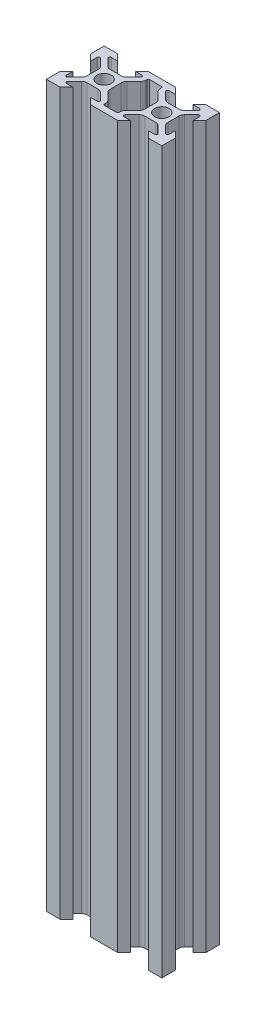
from build123d import *

# Parameters (mm, degrees)
SKETCH1_R           = 2.5
BOSS_EXTRUDE1_DEPTH = 250


with BuildPart() as part:
    # Sketch1 → Boss-Extrude1 (new body)
    with BuildSketch(Plane(origin=(0, 0, 0), x_dir=(0, 0, -1), z_dir=(0, -1, 0))):
        with BuildLine():
            Line((-10, 10), (-10, 5.3))
            Line((-10, 5.3), (-7.8, 3.1))
            Line((-7.8, 3.1), (-7.8, 5.320101013))
            ThreePointArc((-7.8, 5.320101013), (-7.491341716, 5.782040779), (-6.946446609, 5.673654403))
            Line((-6.946446609, 5.673654403), (-4.585786438, 3.312994231))
            ThreePointArc((-4.585786438, 3.312994231), (-4.152240935, 2.664147534), (-4, 1.898780669))
            Line((-4, 1.898780669), (-4, 0))
            Line((-4, 0), (-4, -1.898780669))
            ThreePointArc((-4, -1.898780669), (-4.152240935, -2.664147534), (-4.585786438, -3.312994231))
            Line((-4.585786438, -3.312994231), (-6.946446609, -5.673654403))
            ThreePointArc((-6.946446609, -5.673654403), (-7.491341716, -5.782040779), (-7.8, -5.320101013))
            Line((-7.8, -5.320101013), (-7.8, -3.1))
            Line((-7.8, -3.1), (-10, -5.3))
            Line((-10, -5.3), (-10, -14.7))
            Line((-10, -14.7), (-7.8, -16.9))
            Line((-7.8, -16.9), (-7.8, -14.679898987))
            ThreePointArc((-7.8, -14.679898987), (-7.491341716, -14.217959221), (-6.946446609, -14.326345597))
            Line((-6.946446609, -14.326345597), (-4.585786438, -16.687005769))
            ThreePointArc((-4.585786438, -16.687005769), (-4.152240935, -17.335852466), (-4, -18.101219331))
            Line((-4, -18.101219331), (-4, -20))
            Line((-4, -20), (-4, -21.898780669))
            ThreePointArc((-4, -21.898780669), (-4.152240935, -22.664147534), (-4.585786438, -23.312994231))
            Line((-4.585786438, -23.312994231), (-6.946446609, -25.673654403))
            ThreePointArc((-6.946446609, -25.673654403), (-7.491341716, -25.782040779), (-7.8, -25.320101013))
            Line((-7.8, -25.320101013), (-7.8, -23.1))
            Line((-7.8, -23.1), (-10, -25.3))
            Line((-10, -25.3), (-10, -30))
            Line((-10, -30), (-5.3, -30))
            Line((-5.3, -30), (-3.1, -27.8))
            Line((-3.1, -27.8), (-5.320101013, -27.8))
            ThreePointArc((-5.320101013, -27.8), (-5.782040779, -27.491341716), (-5.673654403, -26.946446609))
            Line((-5.673654403, -26.946446609), (-3.312994231, -24.585786438))
            ThreePointArc((-3.312994231, -24.585786438), (-2.664147534, -24.152240935), (-1.898780669, -24))
            Line((-1.898780669, -24), (1.898780669, -24))
            ThreePointArc((1.898780669, -24), (2.664147534, -24.152240935), (3.312994231, -24.585786438))
            Line((3.312994231, -24.585786438), (5.673654403, -26.946446609))
            ThreePointArc((5.673654403, -26.946446609), (5.782040779, -27.491341716), (5.320101013, -27.8))
            Line((5.320101013, -27.8), (3.1, -27.8))
            Line((3.1, -27.8), (5.3, -30))
            Line((5.3, -30), (10, -30))
            Line((10, -30), (10, -25.3))
            Line((10, -25.3), (7.8, -23.1))
            Line((7.8, -23.1), (7.8, -25.320101013))
            ThreePointArc((7.8, -25.320101013), (7.491341716, -25.782040779), (6.946446609, -25.673654403))
            Line((6.946446609, -25.673654403), (4.585786438, -23.312994231))
            ThreePointArc((4.585786438, -23.312994231), (4.152240935, -22.664147534), (4, -21.898780669))
            Line((4, -21.898780669), (4, -20))
            Line((4, -20), (4, -18.101219331))
            ThreePointArc((4, -18.101219331), (4.152240935, -17.335852466), (4.585786438, -16.687005769))
            Line((4.585786438, -16.687005769), (6.946446609, -14.326345597))
            ThreePointArc((6.946446609, -14.326345597), (7.491341716, -14.217959221), (7.8, -14.679898987))
            Line((7.8, -14.679898987), (7.8, -16.9))
            Line((7.8, -16.9), (10, -14.7))
            Line((10, -14.7), (10, -5.3))
            Line((10, -5.3), (7.8, -3.1))
            Line((7.8, -3.1), (7.8, -5.320101013))
            ThreePointArc((7.8, -5.320101013), (7.491341716, -5.782040779), (6.946446609, -5.673654403))
            Line((6.946446609, -5.673654403), (4.585786438, -3.312994231))
            ThreePointArc((4.585786438, -3.312994231), (4.152240935, -2.664147534), (4, -1.898780669))
            Line((4, -1.898780669), (4, 0))
            Line((4, 0), (4, 1.898780669))
            ThreePointArc((4, 1.898780669), (4.152240935, 2.664147534), (4.585786438, 3.312994231))
            Line((4.585786438, 3.312994231), (6.946446609, 5.673654403))
            ThreePointArc((6.946446609, 5.673654403), (7.491341716, 5.782040779), (7.8, 5.320101013))
            Line((7.8, 5.320101013), (7.8, 3.1))
            Line((7.8, 3.1), (10, 5.3))
            Line((10, 5.3), (10, 10))
            Line((10, 10), (5.3, 10))
            Line((5.3, 10), (3.1, 7.8))
            Line((3.1, 7.8), (5.320101013, 7.8))
            ThreePointArc((5.320101013, 7.8), (5.782040779, 7.491341716), (5.673654403, 6.946446609))
            Line((5.673654403, 6.946446609), (3.312994231, 4.585786438))
            ThreePointArc((3.312994231, 4.585786438), (2.664147534, 4.152240935), (1.898780669, 4))
            Line((1.898780669, 4), (-1.898780669, 4))
            ThreePointArc((-1.898780669, 4), (-2.664147534, 4.152240935), (-3.312994231, 4.585786438))
            Line((-3.312994231, 4.585786438), (-5.673654403, 6.946446609))
            ThreePointArc((-5.673654403, 6.946446609), (-5.782040779, 7.491341716), (-5.320101013, 7.8))
            Line((-5.320101013, 7.8), (-3.1, 7.8))
            Line((-3.1, 7.8), (-5.3, 10))
            Line((-5.3, 10), (-10, 10))
        make_face()
        Circle(SKETCH1_R, mode=Mode.SUBTRACT)
        with Locations(Location((0, -20, 0), (0, 0, 180))):
            Circle(SKETCH1_R, mode=Mode.SUBTRACT)
        with BuildLine():
            Line((-5.673654403, -6.946446609), (-3.312994231, -4.585786438))
            ThreePointArc((-3.312994231, -4.585786438), (-2.664147534, -4.152240935), (-1.898780669, -4))
            Line((-1.898780669, -4), (1.898780669, -4))
            ThreePointArc((1.898780669, -4), (2.664147534, -4.152240935), (3.312994231, -4.585786438))
            Line((3.312994231, -4.585786438), (5.673654403, -6.946446609))
            ThreePointArc((5.673654403, -6.946446609), (6.257616431, -7.336637562), (6.946446609, -7.473654403))
            Line((6.946446609, -7.473654403), (7.3, -7.473654403))
            ThreePointArc((7.3, -7.473654403), (7.653553391, -7.620101013), (7.8, -7.973654403))
            Line((7.8, -7.973654403), (7.8, -12.026345597))
            ThreePointArc((7.8, -12.026345597), (7.653553391, -12.379898987), (7.3, -12.526345597))
            Line((7.3, -12.526345597), (6.946446609, -12.526345597))
            ThreePointArc((6.946446609, -12.526345597), (6.257616431, -12.663362438), (5.673654403, -13.053553391))
            Line((5.673654403, -13.053553391), (3.312994231, -15.414213562))
            ThreePointArc((3.312994231, -15.414213562), (2.664147534, -15.847759065), (1.898780669, -16))
            Line((1.898780669, -16), (-1.898780669, -16))
            ThreePointArc((-1.898780669, -16), (-2.664147534, -15.847759065), (-3.312994231, -15.414213562))
            Line((-3.312994231, -15.414213562), (-5.673654403, -13.053553391))
            ThreePointArc((-5.673654403, -13.053553391), (-6.257616431, -12.663362438), (-6.946446609, -12.526345597))
            Line((-6.946446609, -12.526345597), (-7.3, -12.526345597))
            ThreePointArc((-7.3, -12.526345597), (-7.653553391, -12.379898987), (-7.8, -12.026345597))
            Line((-7.8, -12.026345597), (-7.8, -7.973654403))
            ThreePointArc((-7.8, -7.973654403), (-7.653553391, -7.620101013), (-7.3, -7.473654403))
            Line((-7.3, -7.473654403), (-6.946446609, -7.473654403))
            ThreePointArc((-6.946446609, -7.473654403), (-6.257616431, -7.336637562), (-5.673654403, -6.946446609))
        make_face(mode=Mode.SUBTRACT)
    extrude(amount=-BOSS_EXTRUDE1_DEPTH)


solid = part.part
